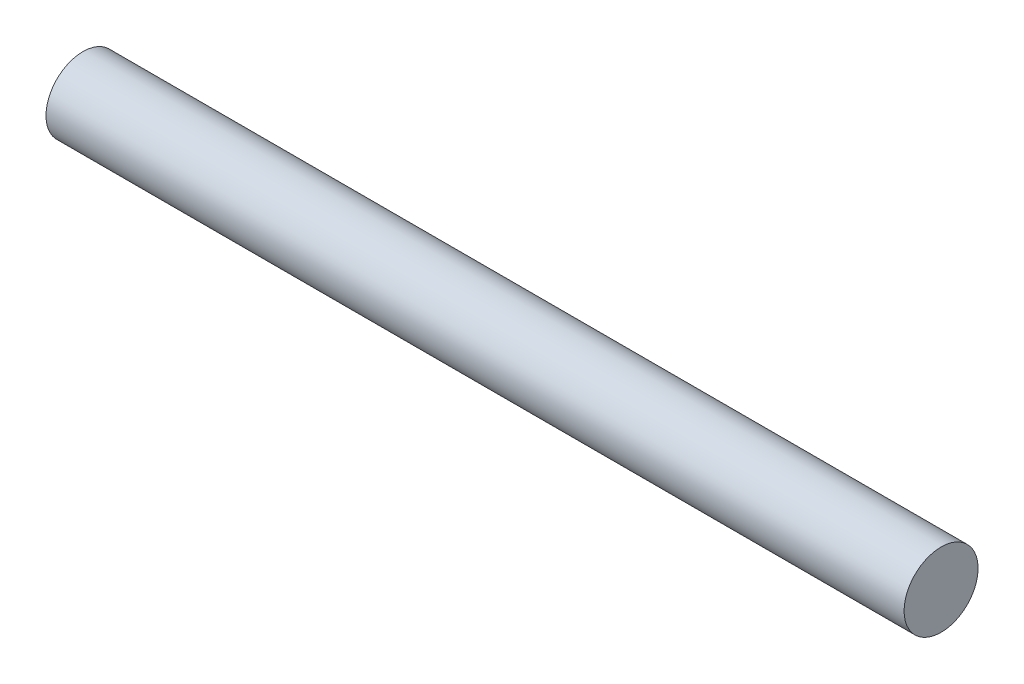
from build123d import *

# Parameters (mm, degrees)
SKETCH1_R           = 2.5
BOSS_EXTRUDE1_DEPTH = 58


with BuildPart() as part:
    # Sketch1 → Boss-Extrude1 (new body)
    with BuildSketch(Plane(origin=(0, 0, 0), x_dir=(0, 0, -1), z_dir=(1, 0, 0))):
        with Locations(Location((0, 0, 0), (0, 0, 180))):
            Circle(SKETCH1_R)
    extrude(amount=BOSS_EXTRUDE1_DEPTH)


solid = part.part
